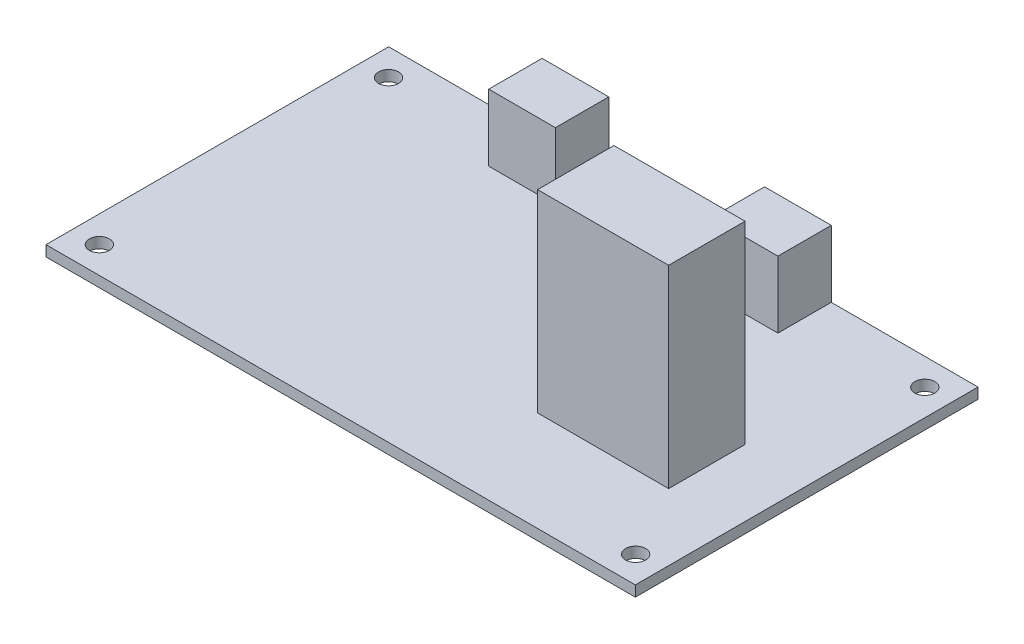
from build123d import *

# Parameters (mm, degrees)
ESQUISSE1_W        = 88.36
ESQUISSE1_H        = 51.38
ESQUISSE1_R        = 1.5
BOSS_EXTRU_2_DEPTH = 1.6
ESQUISSE3_W        = 10
ESQUISSE3_H        = 8
BOSS_EXTRU_3_DEPTH = 10
ESQUISSE4_W        = 19.65008467
ESQUISSE4_H        = 11.451158756
BOSS_EXTRU_4_DEPTH = 29


with BuildPart() as part:
    # Esquisse1 → Boss.-Extru.2 (new body)
    with BuildSketch(Plane(origin=(0, 0, 0), x_dir=(1, 0, 0), z_dir=(0, 1, 0))):
        with Locations((12.941904762, 5.88047619)):
            Rectangle(ESQUISSE1_W, ESQUISSE1_H)
        with Locations(Location((-27.238095238, -15.80952381, 0), (0, 0, 270))):
            Circle(ESQUISSE1_R, mode=Mode.SUBTRACT)
        with Locations(Location((53.171904762, -15.80952381, 0), (0, 0, 270))):
            Circle(ESQUISSE1_R, mode=Mode.SUBTRACT)
        with Locations(Location((53.171904762, 27.55047619, 0), (0, 0, 270))):
            Circle(ESQUISSE1_R, mode=Mode.SUBTRACT)
        with Locations(Location((-27.238095238, 27.55047619, 0), (0, 0, 270))):
            Circle(ESQUISSE1_R, mode=Mode.SUBTRACT)
    extrude(amount=BOSS_EXTRU_2_DEPTH)

    # Esquisse3 → Boss.-Extru.3 (add)
    with BuildSketch(Plane(origin=(0, 1.6, 0), x_dir=(1, 0, 0), z_dir=(0, 1, 0))):
        with Locations((30.121904762, 27.57047619)):
            Rectangle(ESQUISSE3_W, ESQUISSE3_H)
        with Locations((-3.238095238, 27.57047619)):
            Rectangle(ESQUISSE3_W, ESQUISSE3_H)
    extrude(amount=BOSS_EXTRU_3_DEPTH)

    # Esquisse4 → Boss.-Extru.4 (add)
    with BuildSketch(Plane(origin=(0, 1.6, 0), x_dir=(1, 0, 0), z_dir=(0, 1, 0))):
        with Locations((37.296862427, 0.916055568)):
            Rectangle(ESQUISSE4_W, ESQUISSE4_H)
    extrude(amount=BOSS_EXTRU_4_DEPTH)


solid = part.part
